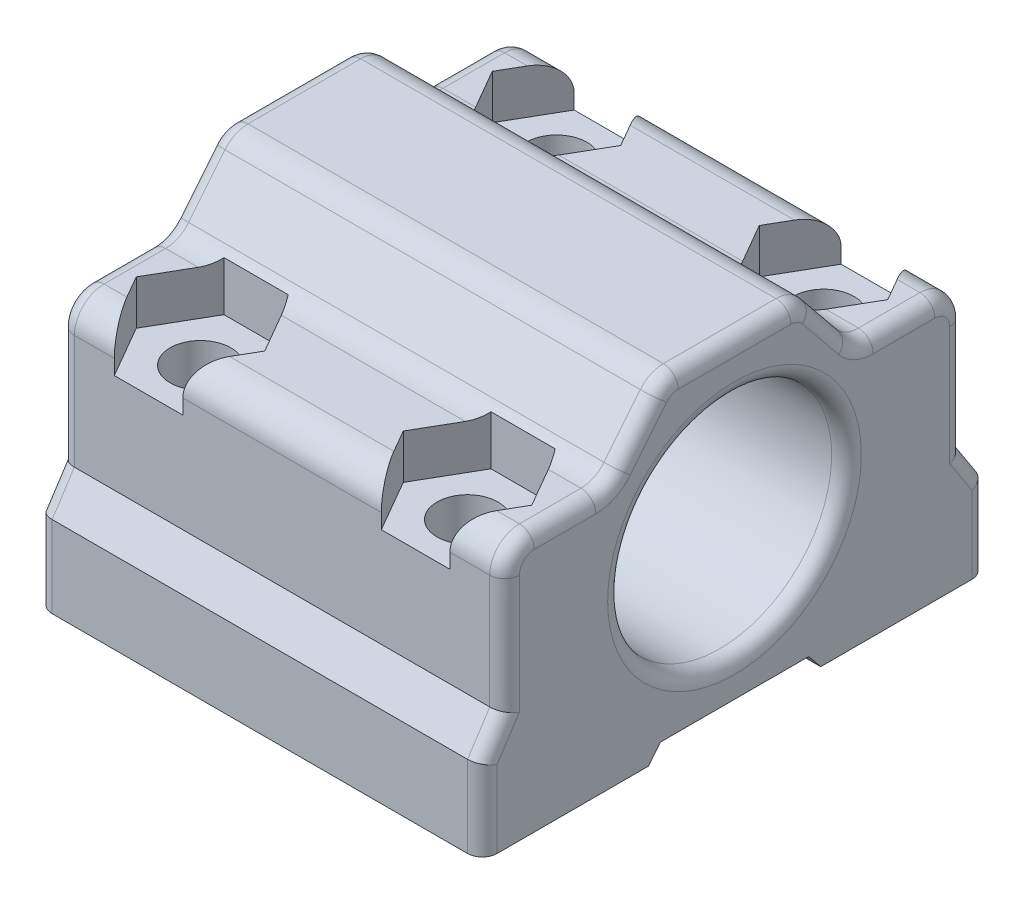
from build123d import *

# Parameters (mm, degrees)
SKETCH1_W               = 30
SKETCH1_H               = 34
BOSS_EXTRUDE1_DEPTH     = 22
SKETCH2_R               = 2.05
CUT_EXTRUDE1_DEPTH      = 22
SKETCH3_R               = 7.55
CUT_EXTRUDE2_DEPTH      = 51.398412673
CUT_EXTRUDE3_DEPTH      = 3
CUT_EXTRUDE3_DEPTH_BACK = 3
FILLET1_R               = 1


with BuildPart() as part:
    # Sketch1 → Boss-Extrude1 (new body)
    with BuildSketch(Plane(origin=(0, 0, 0), x_dir=(1, 0, 0), z_dir=(0, 1, 0))):
        with Locations((15, 17)):
            Rectangle(SKETCH1_W, SKETCH1_H)
    extrude(amount=BOSS_EXTRUDE1_DEPTH)

    # Sketch2 → Cut-Extrude1 (cut)
    with BuildSketch(Plane(origin=(0, 22, 0), x_dir=(1, 0, 0), z_dir=(0, 1, 0))):
        with Locations(Location((6, 29, 0), (0, 0, 270))):
            Circle(SKETCH2_R)
        with Locations(Location((24, 29, 0), (0, 0, 270))):
            Circle(SKETCH2_R)
        with Locations(Location((24, 5, 0), (0, 0, 270))):
            Circle(SKETCH2_R)
        with Locations(Location((6, 5, 0), (0, 0, 270))):
            Circle(SKETCH2_R)
    extrude(amount=-CUT_EXTRUDE1_DEPTH, mode=Mode.SUBTRACT)

    # Sketch3 → Cut-Extrude2 (cut, through all)
    with BuildSketch(Plane.ZY):
        with BuildLine():
            Line((-34, 22), (-34, 5.5))
            Line((-34, 5.5), (-32.5, 7.804886114))
            Line((-32.5, 7.804886114), (-32.5, 15.5))
            ThreePointArc((-32.5, 15.5), (-31.914213562, 16.914213562), (-30.5, 17.5))
            Line((-30.5, 17.5), (-26.35296805, 17.5))
            ThreePointArc((-26.35296805, 17.5), (-25.492668875, 17.694484747), (-24.799684767, 18.240114671))
            Line((-24.799684767, 18.240114671), (-22.350315233, 21.259885329))
            ThreePointArc((-22.350315233, 21.259885329), (-21.657331125, 21.805515253), (-20.79703195, 22))
            Line((-20.79703195, 22), (-34, 22))
        make_face()
        with BuildLine():
            Line((0, 22), (-13.20296805, 22))
            ThreePointArc((-13.20296805, 22), (-12.342668875, 21.805515253), (-11.649684767, 21.259885329))
            Line((-11.649684767, 21.259885329), (-9.200315233, 18.240114671))
            ThreePointArc((-9.200315233, 18.240114671), (-8.507331125, 17.694484747), (-7.64703195, 17.5))
            Line((-7.64703195, 17.5), (-3.5, 17.5))
            ThreePointArc((-3.5, 17.5), (-2.085786438, 16.914213562), (-1.5, 15.5))
            Line((-1.5, 15.5), (-1.5, 7.804886114))
            Line((-1.5, 7.804886114), (0, 5.5))
            Line((0, 5.5), (0, 22))
        make_face()
        with Locations((-17, 11)):
            Circle(SKETCH3_R)
        Polygon((-22, 1), (-22.811111111, 0), (-11.188888889, 0), (-12, 1), align=None)
    extrude(amount=-CUT_EXTRUDE2_DEPTH, mode=Mode.SUBTRACT)

    # Sketch4 → Cut-Extrude3 (cut, two sides: drawn at the far end of the back side and taken through both)
    with BuildSketch(Plane(origin=(0, 17.5, 0), x_dir=(1, 0, 0), z_dir=(0, 1, 0)).offset(-CUT_EXTRUDE3_DEPTH_BACK)):
        Polygon((8.165063509, 32.75), (3.834936491, 32.75), (1.669872981, 29), (3.834936491, 25.25), (8.165063509, 25.25), (10.330127019, 29), align=None)
        Polygon((26.165063509, 32.75), (21.834936491, 32.75), (19.669872981, 29), (21.834936491, 25.25), (26.165063509, 25.25), (28.330127019, 29), align=None)
        Polygon((21.834936491, 1.25), (26.165063509, 1.25), (28.330127019, 5), (26.165063509, 8.75), (21.834936491, 8.75), (19.669872981, 5), align=None)
        Polygon((8.165063509, 1.25), (10.330127019, 5), (8.165063509, 8.75), (3.834936491, 8.75), (1.669872981, 5), (3.834936491, 1.25), align=None)
    extrude(amount=CUT_EXTRUDE3_DEPTH + CUT_EXTRUDE3_DEPTH_BACK, mode=Mode.SUBTRACT)

    # Fillet1
    fillet1_edges = [part.edges().sort_by_distance(p)[0] for p in [
        (0, 22, -17),
        (30, 22, -17),
        (0, 2.75, -34),
        (30, 2.75, -34),
        (30, 2.75, 0),
        (0, 2.75, 0),
        (0, 16.914213562, -2.085786438),
        (30, 17.5, -5.573515975),
        (0, 21.805515253, -12.342668875),
        (0, 6.652443057, -0.75),
        (0, 11.652443057, -1.5),
        (0, 17.694484747, -8.507331125),
        (30, 19.75, -10.425),
        (30, 21.805515253, -12.342668875),
        (30, 6.652443057, -0.75),
        (30, 11.652443057, -1.5),
        (30, 16.914213562, -2.085786438),
        (30, 17.694484747, -8.507331125),
        (0, 19.75, -10.425),
        (0, 17.5, -5.573515975),
        (30, 11, -24.55),
        (0, 11, -24.55),
        (30, 17.5, -28.426484025),
        (30, 16.914213562, -31.914213562),
        (0, 21.805515253, -21.657331125),
        (30, 19.75, -23.575),
        (30, 17.694484747, -25.492668875),
        (30, 11.652443057, -32.5),
        (30, 6.652443057, -33.25),
        (30, 21.805515253, -21.657331125),
        (0, 6.652443057, -33.25),
        (0, 11.652443057, -32.5),
        (0, 16.914213562, -31.914213562),
        (0, 17.5, -28.426484025),
        (0, 17.694484747, -25.492668875),
        (0, 19.75, -23.575),
    ]]
    fillet(fillet1_edges, radius=FILLET1_R)


solid = part.part
